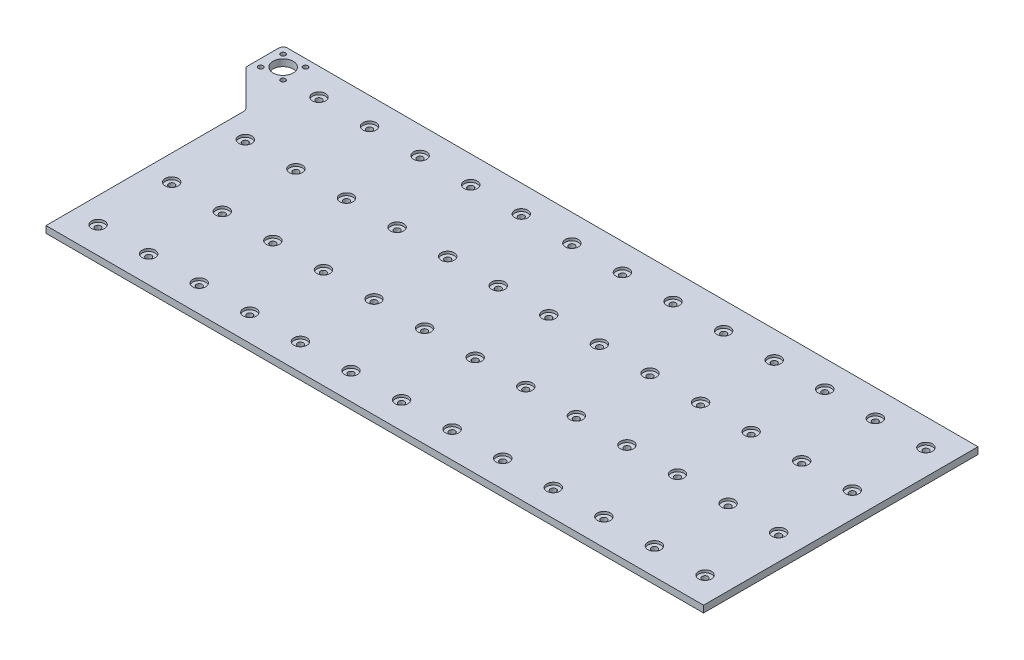
from build123d import *

# Parameters (mm, degrees)
SKETCH1_R            = 2.25
SKETCH1_R_2          = 9.5
BOSS_EXTRUDE1_DEPTH  = 6.35
FILLET1_R            = 4
HOLE1_D              = 5.5
HOLE1_CBORE_D        = 12.24
HOLE1_CBORE_DEPTH    = 2.38125
LPATTERN1_COUNT      = 13
LPATTERN1_PITCH      = 47.4
LPATTERN1_COUNT_DIR2 = 4
LPATTERN1_PITCH_DIR2 = 69


with BuildPart() as part:
    # Sketch1 → Boss-Extrude1 (new body)
    with BuildSketch(Plane(origin=(0, 0, 0), x_dir=(1, 0, 0), z_dir=(0, 1, 0))):
        Polygon((-35, 222.2), (0, 187.2), (0, 0), (616.2, 0), (616.2, 257.2), (0, 257.2), (-35, 257.2), align=None)
        with Locations(Location((-28, 229.2, 0), (0, 0, 270))):
            Circle(SKETCH1_R, mode=Mode.SUBTRACT)
        with Locations(Location((-7, 229.2, 0), (0, 0, 270))):
            Circle(SKETCH1_R, mode=Mode.SUBTRACT)
        with Locations(Location((-7, 250.2, 0), (0, 0, 270))):
            Circle(SKETCH1_R, mode=Mode.SUBTRACT)
        with Locations(Location((-28, 250.2, 0), (0, 0, 270))):
            Circle(SKETCH1_R, mode=Mode.SUBTRACT)
        with Locations(Location((-17.5, 239.7, 0), (0, 0, 270))):
            Circle(SKETCH1_R_2, mode=Mode.SUBTRACT)
    extrude(amount=BOSS_EXTRUDE1_DEPTH)

    # Fillet1
    fillet1_edges = [part.edges().sort_by_distance(p)[0] for p in [
        (0, 3.175, -187.2),
        (-35, 3.175, -222.2),
        (-35, 3.175, -257.2),
    ]]
    fillet(fillet1_edges, radius=FILLET1_R)

    # Hole1 (through all)
    with Locations(Plane(origin=(0, 6.35, 0), x_dir=(1, 0, 0), z_dir=(0, 1, 0))):
        with Locations((23.7, 25.1)):
            hole1 = CounterBoreHole(HOLE1_D / 2, HOLE1_CBORE_D / 2, HOLE1_CBORE_DEPTH)

    # LPattern1: Hole1 13 × 4
    with Locations(*[(i * LPATTERN1_PITCH, 0, -j * LPATTERN1_PITCH_DIR2) for i in range(LPATTERN1_COUNT) for j in range(LPATTERN1_COUNT_DIR2) if (i, j) != (0, 0)]):
        add(hole1, mode=Mode.SUBTRACT)


solid = part.part
